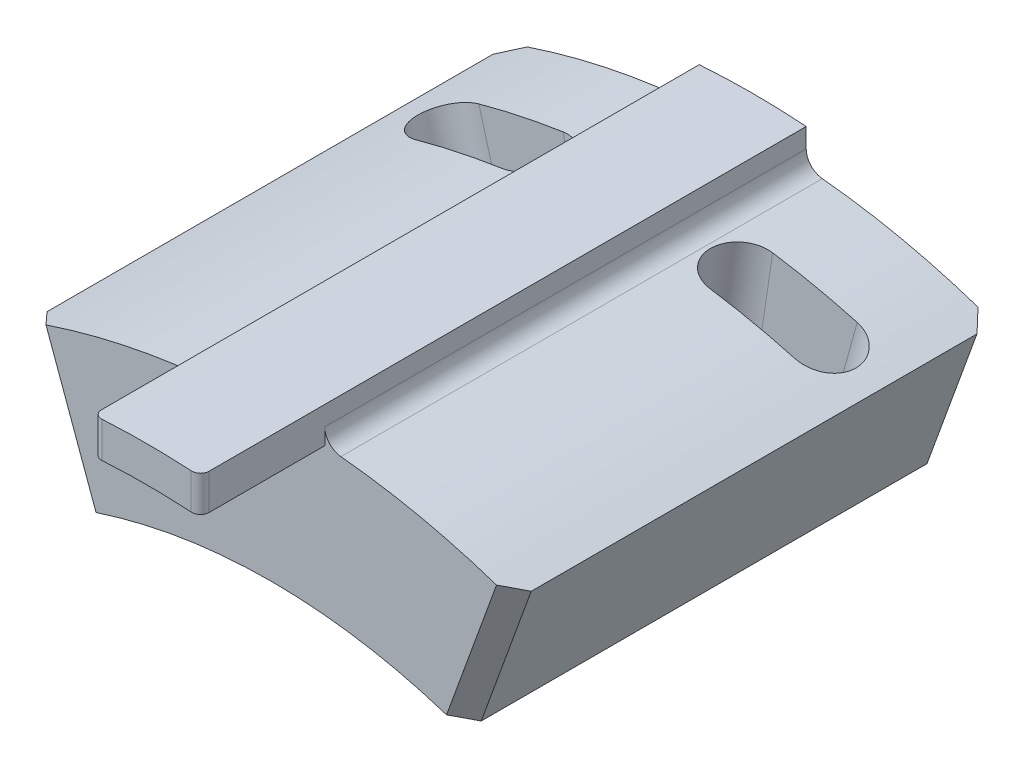
from build123d import *

# Parameters (mm, degrees)
EXTRUDE_1_DEPTH          = 27
EXTRUDE_2_DEPTH          = 7
PATTERN_CIRCULAR_1_COUNT = 2
PATTERN_CIRCULAR_1_ANGLE = 7
CUT_EXTRUDE_2_DEPTH      = 1.75
FILLET_1_R               = 1
CHAMFER_1_SIZE           = 1
FILLET_2_R               = 0.5


with BuildPart() as part:
    # Эскиз1 → Бобышка-Вытянуть1 (new body)
    with BuildSketch(Plane.XY):
        with BuildLine():
            Line((10.773634515, 29.600317555), (13.57819969, 37.305797045))
            ThreePointArc((13.57819969, 37.305797045), (8.367171779, 38.808252169), (3, 39.586487594))
            Line((3, 39.586487594), (3, 41.591946336))
            ThreePointArc((3, 41.591946336), (0, 41.7), (-3, 41.591946336))
            Line((-3, 41.591946336), (-3, 39.586487594))
            ThreePointArc((-3, 39.586487594), (-8.367171779, 38.808252169), (-13.57819969, 37.305797045))
            Line((-13.57819969, 37.305797045), (-10.773634515, 29.600317555))
            ThreePointArc((-10.773634515, 29.600317555), (0, 31.5), (10.773634515, 29.600317555))
        make_face()
    extrude(amount=EXTRUDE_1_DEPTH)

    # Эскиз2 → Бобышка-Вытянуть2 (add)
    with BuildSketch(Plane.XY.offset(27)):
        with BuildLine():
            Line((3, 39.586487594), (3, 41.591946336))
            ThreePointArc((3, 41.591946336), (0, 41.7), (-3, 41.591946336))
            Line((-3, 41.591946336), (-3, 39.586487594))
            ThreePointArc((-3, 39.586487594), (0, 39.7), (3, 39.586487594))
        make_face()
    extrude(amount=EXTRUDE_2_DEPTH)

    # Эскиз4 → Вырез-Повернуть1 (revolve, cut)
    with BuildSketch(Plane.XY.offset(6.5)):
        Polygon((13.712080217, 42.895703236), (8.367312695, 23.623094172), (6.680959402, 24.09076133), (12.025726924, 43.363370394), align=None)
    cut_revolve_1 = revolve(axis=Axis((0, 0, 6.5), (0.2672383760782575, 0.9636304532086228, 0)), mode=Mode.SUBTRACT)

    # Круговой массив1: Вырез-Повернуть1 ×2 about axis
    pattern_circular_1_axis = Axis((0, 0, 27), (0, 0, 1))
    for i in range(1, PATTERN_CIRCULAR_1_COUNT):
        add(cut_revolve_1.rotate(pattern_circular_1_axis, i * PATTERN_CIRCULAR_1_ANGLE / (PATTERN_CIRCULAR_1_COUNT - 1)), mode=Mode.SUBTRACT)

    # Эскиз6 → Вырез-Вытянуть2 (cut, symmetric)
    with BuildSketch(Plane.XY.offset(6.5)):
        with BuildLine():
            Line((4.655996451, 31.153999696), (5.868033622, 39.263929775))
            ThreePointArc((5.868033622, 39.263929775), (8.254094125, 38.832459749), (10.60936353, 38.256128992))
            Line((10.60936353, 38.256128992), (8.418008846, 30.354359276))
            ThreePointArc((8.418008846, 30.354359276), (6.549218261, 30.811649423), (4.655996451, 31.153999696))
        make_face()
    cut_extrude_2 = extrude(amount=CUT_EXTRUDE_2_DEPTH, both=True, mode=Mode.SUBTRACT)

    # Зеркальное отражение1: Вырез-Повернуть1, Вырез-Вытянуть2 across plane
    add(cut_revolve_1.mirror(Plane(origin=(0, 0, 0), x_dir=(0, 0, 1), z_dir=(1, 0, 0))), mode=Mode.SUBTRACT)
    add(cut_extrude_2.mirror(Plane(origin=(0, 0, 0), x_dir=(0, 0, 1), z_dir=(1, 0, 0))), mode=Mode.SUBTRACT)

    # Зеркальное отражение1 copy 1 sketch → Зеркальное отражение1 copy 1 (revolve, cut)
    with BuildSketch(Plane(origin=(0, 0, 6.5), x_dir=(-0.992546151641322, 0.12186934340514775, 0), z_dir=(0, 0, 1))):
        Polygon((13.712080217, -42.895703236), (8.367312695, -23.623094172), (6.680959402, -24.09076133), (12.025726924, -43.363370394), align=None)
    revolve(axis=Axis((0, 0, 6.5), (0.147809411129611, -0.9890158633619167, 0)), mode=Mode.SUBTRACT)

    # Скругление1
    fillet_1_edges = [part.edges().sort_by_distance(p)[0] for p in [
        (-3, 39.586487594, 13.5),
        (3, 39.586487594, 13.5),
    ]]
    fillet(fillet_1_edges, radius=FILLET_1_R)

    # Фаска1
    chamfer_1_edges = [part.edges().sort_by_distance(p)[0] for p in [
        (12.175917102, 33.4530573, 0),
        (-12.175917102, 33.4530573, 27),
        (-12.175917102, 33.4530573, 0),
        (12.175917102, 33.4530573, 27),
    ]]
    chamfer(chamfer_1_edges, length=CHAMFER_1_SIZE)

    # Скругление2
    fillet_2_edges = [part.edges().sort_by_distance(p)[0] for p in [
        (-3, 40.589216965, 34),
        (3, 40.589216965, 34),
    ]]
    fillet(fillet_2_edges, radius=FILLET_2_R)


solid = part.part
